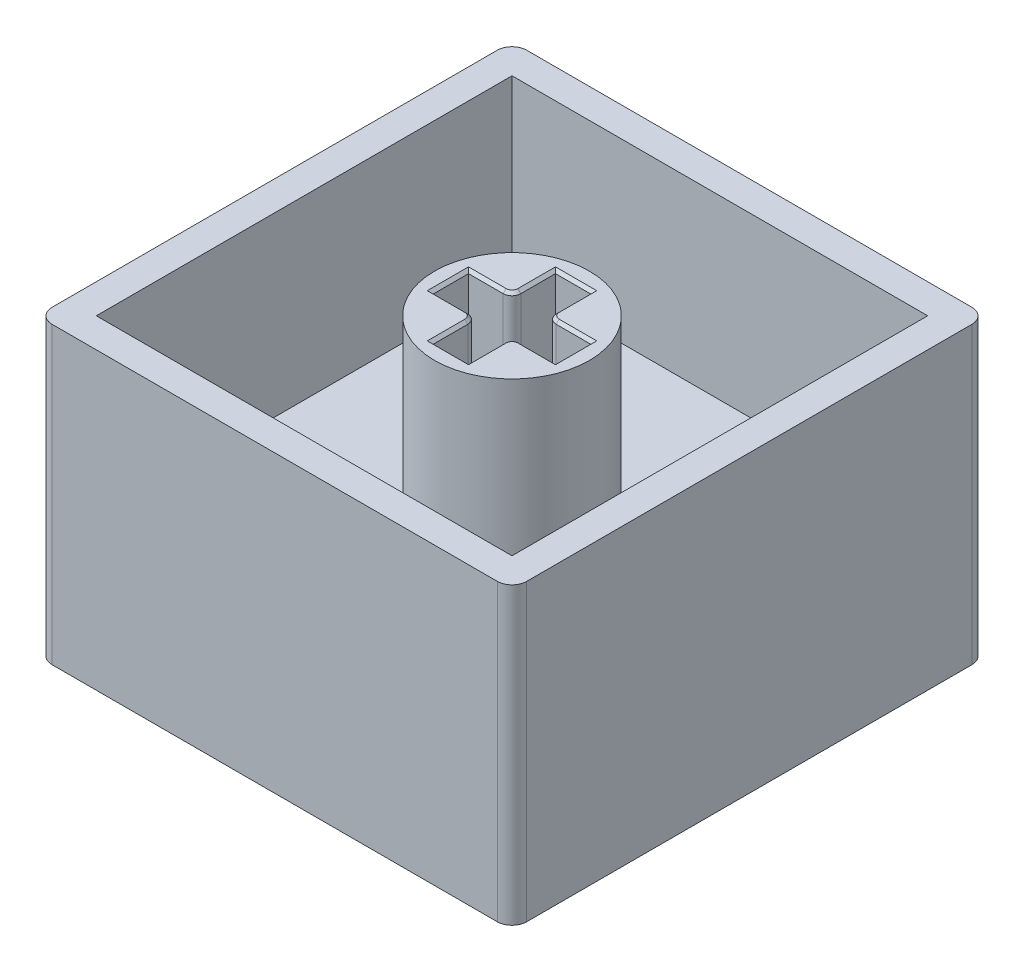
from build123d import *

# Parameters (mm, degrees)
SKETCH1_W           = 16.1
SKETCH1_H           = 16.1
SKETCH1_W_2         = 14.1
SKETCH1_H_2         = 14.1
BOSS_EXTRUDE1_DEPTH = 10
SKETCH1_2_W         = 14.1
SKETCH1_2_H         = 14.1
BOSS_EXTRUDE2_DEPTH = 4
SKETCH2_R           = 2.625
BOSS_EXTRUDE3_DEPTH = 6
CHAMFER1_SIZE       = 0.1
FILLET1_R           = 0.5


with BuildPart() as part:
    # Sketch1 → Boss-Extrude1 (new body)
    with BuildSketch(Plane(origin=(0, 0, 0), x_dir=(1, 0, 0), z_dir=(0, 1, 0))):
        Rectangle(SKETCH1_W, SKETCH1_H)
        Rectangle(SKETCH1_W_2, SKETCH1_H_2, mode=Mode.SUBTRACT)
    extrude(amount=BOSS_EXTRUDE1_DEPTH)

    # Sketch1<2> → Boss-Extrude2 (add)
    with BuildSketch(Plane(origin=(0, 0, 0), x_dir=(1, 0, 0), z_dir=(0, 1, 0))):
        Rectangle(SKETCH1_2_W, SKETCH1_2_H)
    extrude(amount=BOSS_EXTRUDE2_DEPTH)

    # Sketch2 → Boss-Extrude3 (add)
    with BuildSketch(Plane(origin=(0, 4, 0), x_dir=(1, 0, 0), z_dir=(0, 1, 0))):
        with Locations(Location((0, 0, 0), (0, 0, 90))):
            Circle(SKETCH2_R)
        with BuildLine():
            Line((-0.9, -0.6), (-2.075, -0.6))
            Line((-2.075, -0.6), (-2.075, 0.6))
            Line((-2.075, 0.6), (-0.9, 0.6))
            ThreePointArc((-0.9, 0.6), (-0.687867966, 0.687867966), (-0.6, 0.9))
            Line((-0.6, 0.9), (-0.6, 2.075))
            Line((-0.6, 2.075), (0.6, 2.075))
            Line((0.6, 2.075), (0.6, 0.9))
            ThreePointArc((0.6, 0.9), (0.687867966, 0.687867966), (0.9, 0.6))
            Line((0.9, 0.6), (2.075, 0.6))
            Line((2.075, 0.6), (2.075, -0.6))
            Line((2.075, -0.6), (0.9, -0.6))
            ThreePointArc((0.9, -0.6), (0.687867966, -0.687867966), (0.6, -0.9))
            Line((0.6, -0.9), (0.6, -2.075))
            Line((0.6, -2.075), (-0.6, -2.075))
            Line((-0.6, -2.075), (-0.6, -0.9))
            ThreePointArc((-0.6, -0.9), (-0.687867966, -0.687867966), (-0.9, -0.6))
        make_face(mode=Mode.SUBTRACT)
    extrude(amount=BOSS_EXTRUDE3_DEPTH)

    # Chamfer1
    chamfer1_edges = [part.edges().sort_by_distance(p)[0] for p in [
        (0.687867966, 10, 0.687867966),
        (0, 10, 2.075),
        (-0.6, 10, 1.4875),
        (-0.687867966, 10, 0.687867966),
        (-2.075, 10, 0),
        (-1.4875, 10, -0.6),
        (-0.687867966, 10, -0.687867966),
        (-0.6, 10, -1.4875),
        (0.687867966, 10, -0.687867966),
        (1.4875, 10, -0.6),
        (1.4875, 10, 0.6),
        (0.6, 10, 1.4875),
        (-1.4875, 10, 0.6),
        (0, 10, -2.075),
        (0.6, 10, -1.4875),
        (2.075, 10, 0),
    ]]
    chamfer(chamfer1_edges, length=CHAMFER1_SIZE)

    # Fillet1
    fillet1_edges = [part.edges().sort_by_distance(p)[0] for p in [
        (8.05, 5, 8.05),
        (-8.05, 5, 8.05),
        (-8.05, 5, -8.05),
        (8.05, 5, -8.05),
    ]]
    fillet(fillet1_edges, radius=FILLET1_R)


solid = part.part
